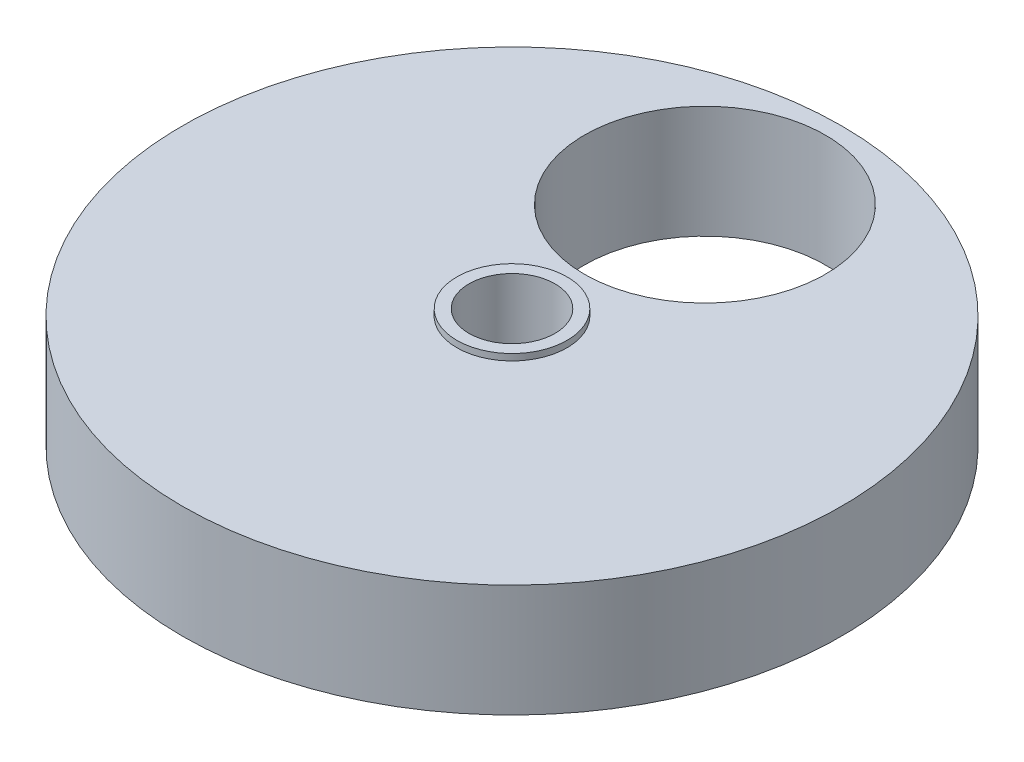
from build123d import *

# Parameters (mm, degrees)
SKETCH1_R           = 20.5
BOSS_EXTRUDE1_DEPTH = 7
SKETCH2_R           = 2.675
CUT_EXTRUDE1_DEPTH  = 7
BOSS_EXTRUDE2_START = 0.4
SKETCH3_R           = 3.425
SKETCH3_R_2         = 2.675
BOSS_EXTRUDE2_DEPTH = 0.4
SKETCH5_R           = 7.5
CUT_EXTRUDE3_DEPTH  = 7


with BuildPart() as part:
    # Sketch1 → Boss-Extrude1 (new body)
    with BuildSketch(Plane(origin=(0, 0, 0), x_dir=(1, 0, 0), z_dir=(0, 1, 0))):
        with Locations(Location((0, 0, 0), (0, 0, 270))):
            Circle(SKETCH1_R)
    extrude(amount=BOSS_EXTRUDE1_DEPTH)

    # Sketch2 → Cut-Extrude1 (cut)
    with BuildSketch(Plane(origin=(0, 7, 0), x_dir=(1, 0, 0), z_dir=(0, 1, 0))):
        with Locations(Location((0, 0, 0), (0, 0, 270))):
            Circle(SKETCH2_R)
    extrude(amount=-CUT_EXTRUDE1_DEPTH, mode=Mode.SUBTRACT)

    # Sketch3 → Boss-Extrude2 (add)
    with BuildSketch(Plane(origin=(0, 7, 0), x_dir=(1, 0, 0), z_dir=(0, 1, 0)).offset(BOSS_EXTRUDE2_START)):
        with Locations(Location((0, 0, 0), (0, 0, 270))):
            Circle(SKETCH3_R)
        with Locations(Location((0, 0, 0), (0, 0, 270))):
            Circle(SKETCH3_R_2, mode=Mode.SUBTRACT)
    extrude(amount=-BOSS_EXTRUDE2_DEPTH)

    # Sketch5 → Cut-Extrude3 (cut)
    with BuildSketch(Plane(origin=(0, 7, 0), x_dir=(1, 0, 0), z_dir=(0, 1, 0))):
        with Locations(Location((0, 12, 0), (0, 0, 270))):
            Circle(SKETCH5_R)
    extrude(amount=-CUT_EXTRUDE3_DEPTH, mode=Mode.SUBTRACT)


solid = part.part
